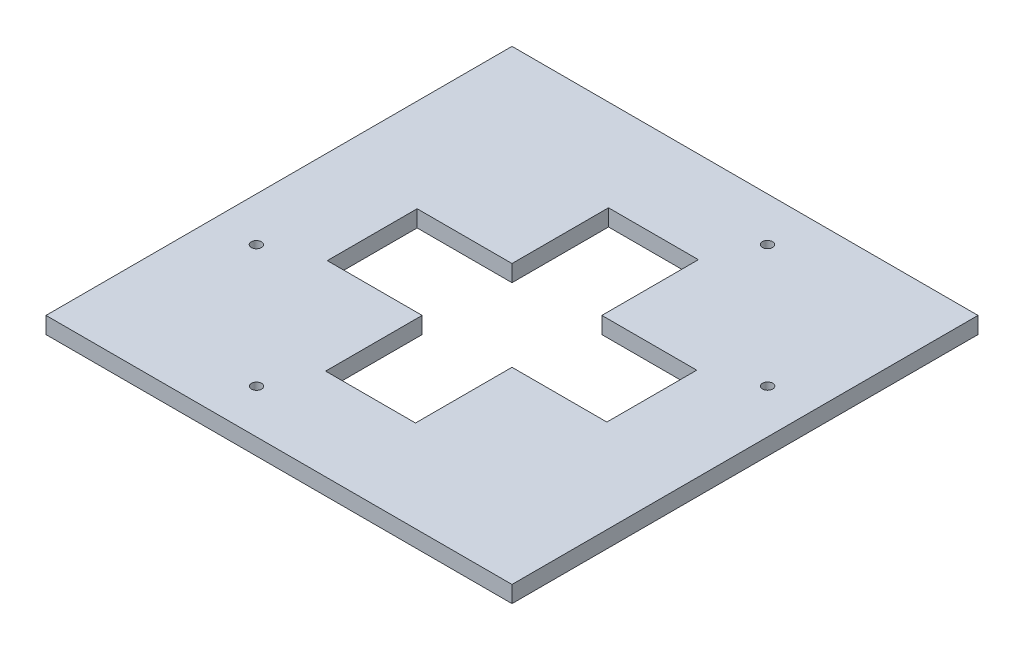
from build123d import *

# Parameters (mm, degrees)
SKETCH1_W           = 140
SKETCH1_H           = 140
BOSS_EXTRUDE1_DEPTH = 5
CUT_EXTRUDE2_DEPTH  = 5
SKETCH3_W           = 26
SKETCH3_H           = 26
CUT_EXTRUDE3_DEPTH  = 5
SKETCH5_R           = 1.525
CUT_EXTRUDE5_DEPTH  = 5
SKETCH7_W           = 0.499998827
SKETCH7_H           = 0.5
SKETCH7_W_2         = 0.5
CUT_EXTRUDE6_DEPTH  = 5


with BuildPart() as part:
    # Sketch1 → Boss-Extrude1 (new body)
    with BuildSketch(Plane(origin=(0, 0, 0), x_dir=(1, 0, 0), z_dir=(0, 1, 0))):
        Rectangle(SKETCH1_W, SKETCH1_H)
    extrude(amount=BOSS_EXTRUDE1_DEPTH)

    # Sketch2 → Cut-Extrude2 (cut)
    with BuildSketch(Plane(origin=(0, 5, 0), x_dir=(1, 0, 0), z_dir=(0, 1, 0))):
        Polygon((-13, 13), (13, 13), (13, 13.5), (13.5, 13.5), (13.5, 42.495538118), (-13.499998827, 42.495538118), (-13.499998827, 13.5), (-13, 13.5), align=None)
        Polygon((-13.499998827, -13), (-13, -13), (-13, 13), (-13.499998827, 13), (-13.499998827, 13.5), (-42, 13.5), (-42, -13.5), (-13.499998827, -13.5), align=None)
        Polygon((13, 13), (13, -13), (13.5, -13), (13.5, -13.5), (42, -13.5), (42, 13.5), (13.5, 13.5), (13.5, 13), align=None)
        Polygon((13.5, -13.5), (13, -13.5), (13, -13), (-13, -13), (-13, -13.5), (-13.499998827, -13.5), (-13.499998827, -42.495538118), (13.5, -42.495538118), align=None)
    extrude(amount=-CUT_EXTRUDE2_DEPTH, mode=Mode.SUBTRACT)

    # Sketch3 → Cut-Extrude3 (cut)
    with BuildSketch(Plane(origin=(0, 5, 0), x_dir=(1, 0, 0), z_dir=(0, 1, 0))):
        Rectangle(SKETCH3_W, SKETCH3_H)
    extrude(amount=-CUT_EXTRUDE3_DEPTH, mode=Mode.SUBTRACT)

    # Sketch5 → Cut-Extrude5 (cut)
    with BuildSketch(Plane(origin=(0, 5, 0), x_dir=(1, 0, 0), z_dir=(0, 1, 0))):
        with Locations(Location((-56.8, -19.996300578, 0), (0, 0, 270))):
            Circle(SKETCH5_R)
        with Locations(Location((-19.95, -56.803699422, 0), (0, 0, 270))):
            Circle(SKETCH5_R)
        with Locations(Location((19.95, 56.803699422, 0), (0, 0, 270))):
            Circle(SKETCH5_R)
        with Locations(Location((56.8, 19.996300578, 0), (0, 0, 270))):
            Circle(SKETCH5_R)
    extrude(amount=-CUT_EXTRUDE5_DEPTH, mode=Mode.SUBTRACT)

    # Sketch7 → Cut-Extrude6 (cut)
    with BuildSketch(Plane(origin=(0, 5, 0), x_dir=(1, 0, 0), z_dir=(0, 1, 0))):
        with Locations((-13.249999413, -13.25)):
            Rectangle(SKETCH7_W, SKETCH7_H)
        with Locations((-13.249999413, 13.25)):
            Rectangle(SKETCH7_W, SKETCH7_H)
        with Locations((13.25, 13.25)):
            Rectangle(SKETCH7_W_2, SKETCH7_H)
        with Locations((13.25, -13.25)):
            Rectangle(SKETCH7_W_2, SKETCH7_H)
    extrude(amount=-CUT_EXTRUDE6_DEPTH, mode=Mode.SUBTRACT)


solid = part.part
